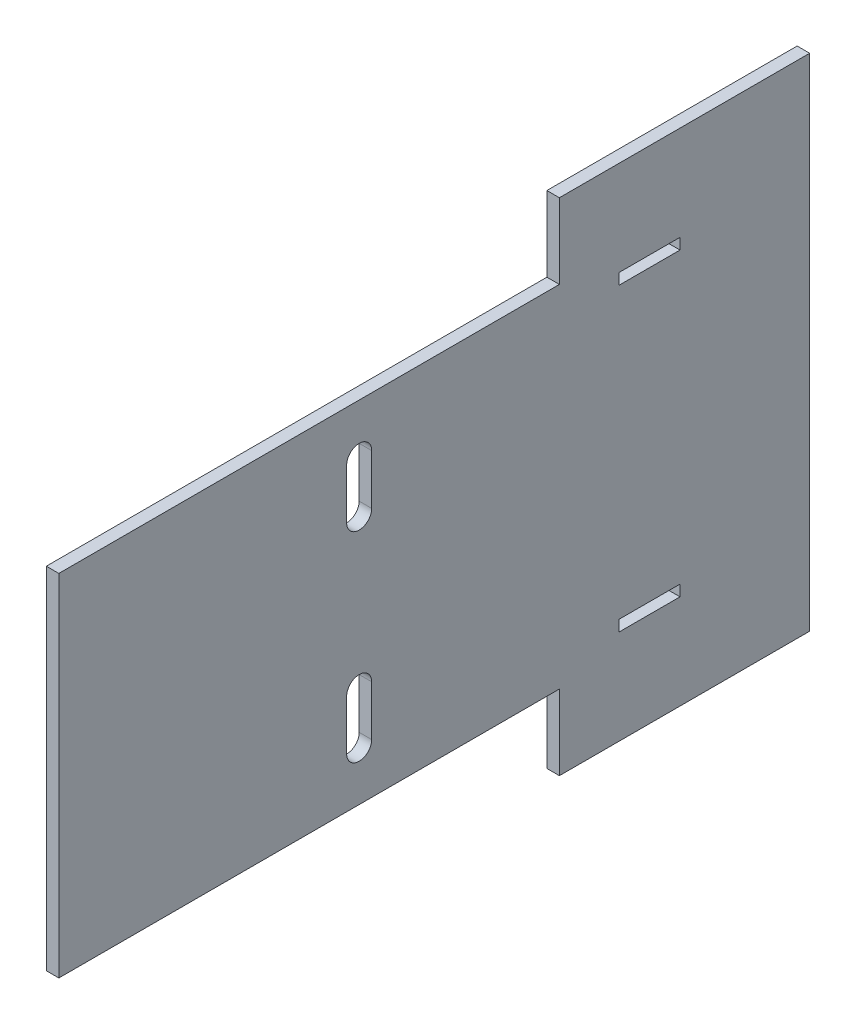
from build123d import *

# Parameters (mm, degrees)
BOSS_EXTRUDE1_DEPTH = 2.5
SKETCH4_W           = 2.2
SKETCH4_H           = 12.2
CUT_EXTRUDE1_DEPTH  = 159.133646009
CUT_EXTRUDE2_DEPTH  = 159.133646009


with BuildPart() as part:
    # Sketch1 → Boss-Extrude1 (new body)
    with BuildSketch(Plane.YZ):
        Polygon((50, 0), (50, 50), (35, 50), (35, 150), (-35, 150), (-35, 50), (-50, 50), (-50, 0), (0, 0), align=None)
    extrude(amount=BOSS_EXTRUDE1_DEPTH)

    # Sketch4 → Cut-Extrude1 (cut, through all)
    with BuildSketch(Plane(origin=(0, 0, 0), x_dir=(0, -1, 0), z_dir=(-1, 0, 0))):
        with Locations((-30, 32)):
            Rectangle(SKETCH4_W, SKETCH4_H)
        with Locations((30, 32)):
            Rectangle(SKETCH4_W, SKETCH4_H)
    extrude(amount=-CUT_EXTRUDE1_DEPTH, mode=Mode.SUBTRACT)

    # Sketch6 → Cut-Extrude2 (cut, through all)
    with BuildSketch(Plane(origin=(0, 0, 0), x_dir=(0, -1, 0), z_dir=(-1, 0, 0))):
        with BuildLine():
            Line((-25, 92.5), (-15, 92.5))
            ThreePointArc((-15, 92.5), (-12.5, 90), (-15, 87.5))
            Line((-15, 87.5), (-25, 87.5))
            ThreePointArc((-25, 87.5), (-27.5, 90), (-25, 92.5))
        make_face()
        with BuildLine():
            Line((15, 92.5), (25, 92.5))
            ThreePointArc((25, 92.5), (27.5, 90), (25, 87.5))
            Line((25, 87.5), (15, 87.5))
            ThreePointArc((15, 87.5), (12.5, 90), (15, 92.5))
        make_face()
    extrude(amount=-CUT_EXTRUDE2_DEPTH, mode=Mode.SUBTRACT)


solid = part.part
